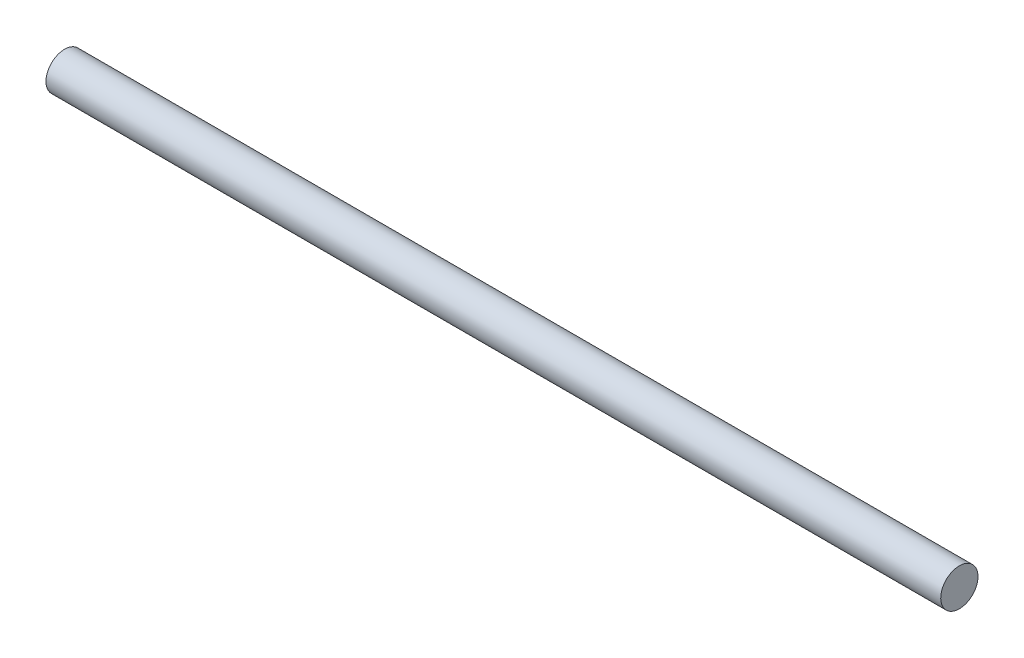
from build123d import *

# Parameters (mm, degrees)
SKETCH1_W = 12
SKETCH1_H = 0.5
SKETCH3_W = 12
SKETCH3_H = 0.5


with BuildPart() as part:
    # Sketch1 → Revolve1 (revolve)
    with BuildSketch(Plane(origin=(0, 0, 0), x_dir=(-1, 0, 0), z_dir=(0, 0, -1))):
        with Locations((6, 0.25)):
            Rectangle(SKETCH1_W, SKETCH1_H)
    revolve(axis=Axis((0, 0, 0), (-1, 0, 0)))

    # Sketch3 → Revolve2 (revolve)
    with BuildSketch(Plane.XY):
        with Locations((6, 0.25)):
            Rectangle(SKETCH3_W, SKETCH3_H)
    revolve(axis=Axis((12, 0, 0), (-1, 0, 0)))


solid = part.part
